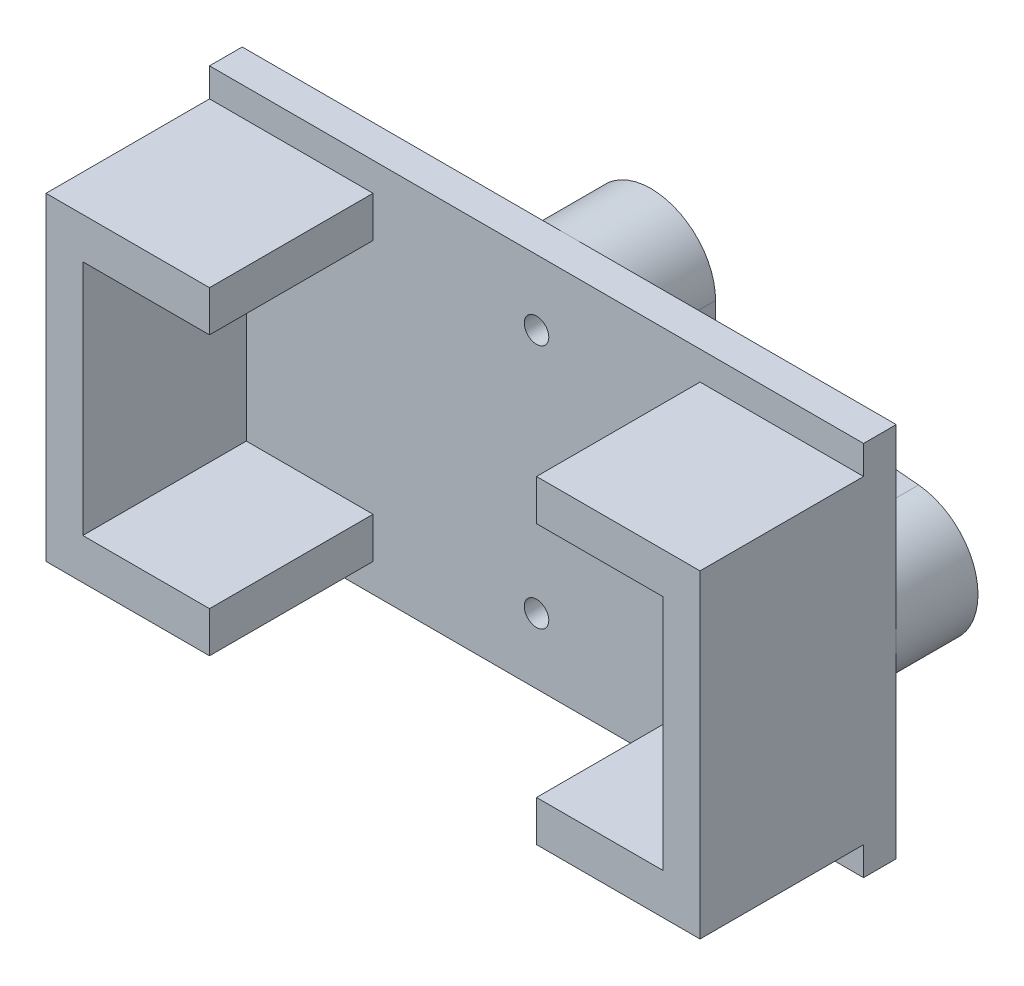
from build123d import *

# Parameters (mm, degrees)
SALIENTE_EXTRUIR1_DEPTH = 5
CROQUIS2_W              = 40
CROQUIS2_H              = 23
SALIENTE_EXTRUIR2_DEPTH = 2
SALIENTE_EXTRUIR3_DEPTH = 10
CROQUIS4_R              = 0.75
CORTAR_EXTRUIR1_DEPTH   = 10


with BuildPart() as part:
    # Croquis1 → Saliente-Extruir1 (new body)
    with BuildSketch(Plane.XY):
        with BuildLine():
            Line((-3.95, -5.119042668), (-16.364400449, -3.983366957))
            ThreePointArc((-16.364400449, -3.983366957), (-20, 0), (-16.364400449, 3.983366957))
            Line((-16.364400449, 3.983366957), (-3.95, 5.119042668))
            Line((-3.95, 5.119042668), (-3.95, 7.55))
            ThreePointArc((-3.95, 7.55), (0, 11.5), (3.95, 7.55))
            Line((3.95, 7.55), (3.95, 5.119042668))
            Line((3.95, 5.119042668), (16.364400449, 3.983366957))
            ThreePointArc((16.364400449, 3.983366957), (20, 0), (16.364400449, -3.983366957))
            Line((16.364400449, -3.983366957), (3.95, -5.119042668))
            Line((3.95, -5.119042668), (3.95, -7.55))
            ThreePointArc((3.95, -7.55), (0, -11.5), (-3.95, -7.55))
            Line((-3.95, -7.55), (-3.95, -5.119042668))
        make_face()
        with BuildLine():
            Line((-2.45, 3.75), (-16.227750281, 2.489604348))
            ThreePointArc((-16.227750281, 2.489604348), (-18.5, 0), (-16.227750281, -2.489604348))
            Line((-16.227750281, -2.489604348), (-2.45, -3.75))
            Line((-2.45, -3.75), (-2.45, -7.55))
            ThreePointArc((-2.45, -7.55), (0, -10), (2.45, -7.55))
            Line((2.45, -7.55), (2.45, -3.75))
            Line((2.45, -3.75), (16.227750281, -2.489604348))
            ThreePointArc((16.227750281, -2.489604348), (18.5, 0), (16.227750281, 2.489604348))
            Line((16.227750281, 2.489604348), (2.45, 3.75))
            Line((2.45, 3.75), (2.45, 7.55))
            ThreePointArc((2.45, 7.55), (0, 10), (-2.45, 7.55))
            Line((-2.45, 7.55), (-2.45, 3.75))
        make_face(mode=Mode.SUBTRACT)
    extrude(amount=SALIENTE_EXTRUIR1_DEPTH)

    # Croquis2 → Saliente-Extruir2 (add)
    with BuildSketch(Plane.XY.offset(5)):
        Rectangle(CROQUIS2_W, CROQUIS2_H)
    extrude(amount=SALIENTE_EXTRUIR2_DEPTH)

    # Croquis3 → Saliente-Extruir3 (add)
    with BuildSketch(Plane.XY.offset(7)):
        Polygon((-10, 7.25), (-10, 9.75), (-20, 9.75), (-20, -9.75), (-10, -9.75), (-10, -7.25), (-17.75, -7.25), (-17.75, 7.25), align=None)
        Polygon((17.75, 7.25), (17.75, -7.25), (10, -7.25), (10, -9.75), (20, -9.75), (20, 9.75), (10, 9.75), (10, 7.25), align=None)
    extrude(amount=SALIENTE_EXTRUIR3_DEPTH)

    # Croquis4 → Cortar-Extruir1 (cut)
    with BuildSketch(Plane(origin=(0, 0, 5), x_dir=(-1, 0, 0), z_dir=(0, 0, -1))):
        with Locations((0, -7.5)):
            Circle(CROQUIS4_R)
        with Locations((0, 7.5)):
            Circle(CROQUIS4_R)
    extrude(amount=-CORTAR_EXTRUIR1_DEPTH, mode=Mode.SUBTRACT)


solid = part.part
